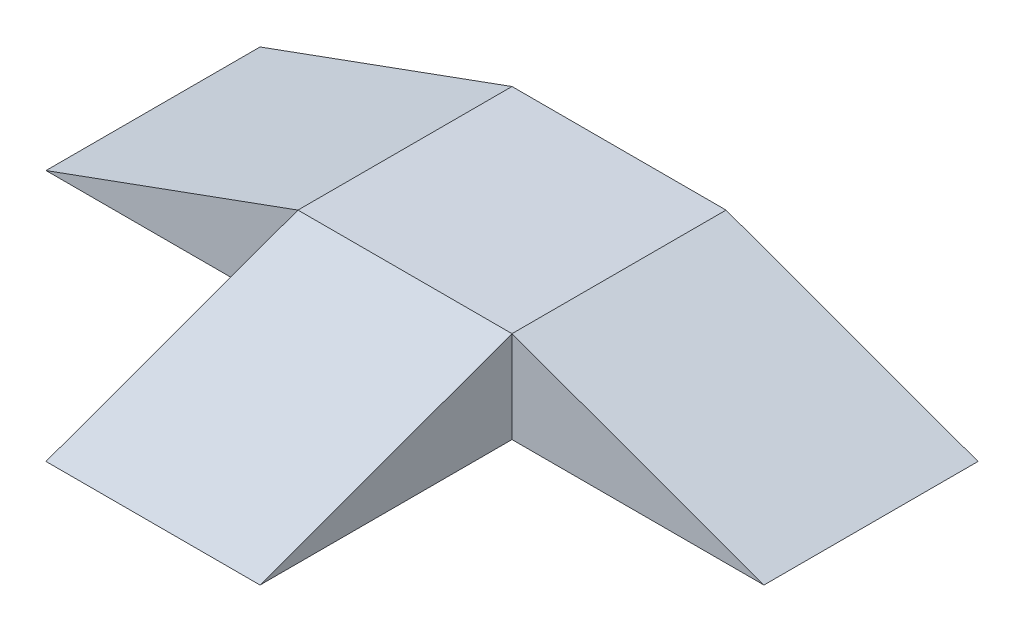
from build123d import *

# Parameters (mm, degrees)
SKETCH1_W           = 3500
SKETCH1_H           = 3500
BOSS_EXTRUDE1_DEPTH = 1500
SKETCH1_5_W         = 3500
SKETCH1_5_H         = 4120
SKETCH1_5_W_2       = 4120
SKETCH1_5_H_2       = 3500
BOSS_EXTRUDE2_DEPTH = 1500
CUT_EXTRUDE1_DEPTH  = 9736.055212992
CUT_EXTRUDE2_DEPTH  = 7327.752350121
CUT_EXTRUDE4_DEPTH  = 7327.752350121


with BuildPart() as part:
    # Sketch1 → Boss-Extrude1 (new body)
    with BuildSketch(Plane(origin=(0, 0, 0), x_dir=(1, 0, 0), z_dir=(0, 1, 0))):
        Rectangle(SKETCH1_W, SKETCH1_H)
    extrude(amount=BOSS_EXTRUDE1_DEPTH)

    # Sketch1<5> → Boss-Extrude2 (add)
    with BuildSketch(Plane(origin=(0, 0, 0), x_dir=(1, 0, 0), z_dir=(0, 1, 0))):
        with Locations((0, -3810)):
            Rectangle(SKETCH1_5_W, SKETCH1_5_H)
        with Locations((3810, 0)):
            Rectangle(SKETCH1_5_W_2, SKETCH1_5_H_2)
        with Locations((-3810, 0)):
            Rectangle(SKETCH1_5_W_2, SKETCH1_5_H_2)
    extrude(amount=BOSS_EXTRUDE2_DEPTH)

    # Sketch2 → Cut-Extrude1 (cut, through all)
    with BuildSketch(Plane(origin=(1750, 0, 0), x_dir=(0, 0, -1), z_dir=(1, 0, 0))):
        Polygon((-1750, 1500), (-5870, 0), (-5870, 1500), align=None)
    extrude(amount=-CUT_EXTRUDE1_DEPTH, mode=Mode.SUBTRACT)

    # Sketch3 → Cut-Extrude2 (cut, through all)
    with BuildSketch(Plane.XY.offset(1750)):
        Polygon((-5870, 0), (-1750, 1500), (-5870, 1500), align=None)
    extrude(amount=-CUT_EXTRUDE2_DEPTH, mode=Mode.SUBTRACT)

    # Sketch4 → Cut-Extrude4 (cut, through all)
    with BuildSketch(Plane.XY.offset(1750)):
        Polygon((1750, 1500), (5870, 0), (5870, 1500), align=None)
    extrude(amount=-CUT_EXTRUDE4_DEPTH, mode=Mode.SUBTRACT)


solid = part.part
